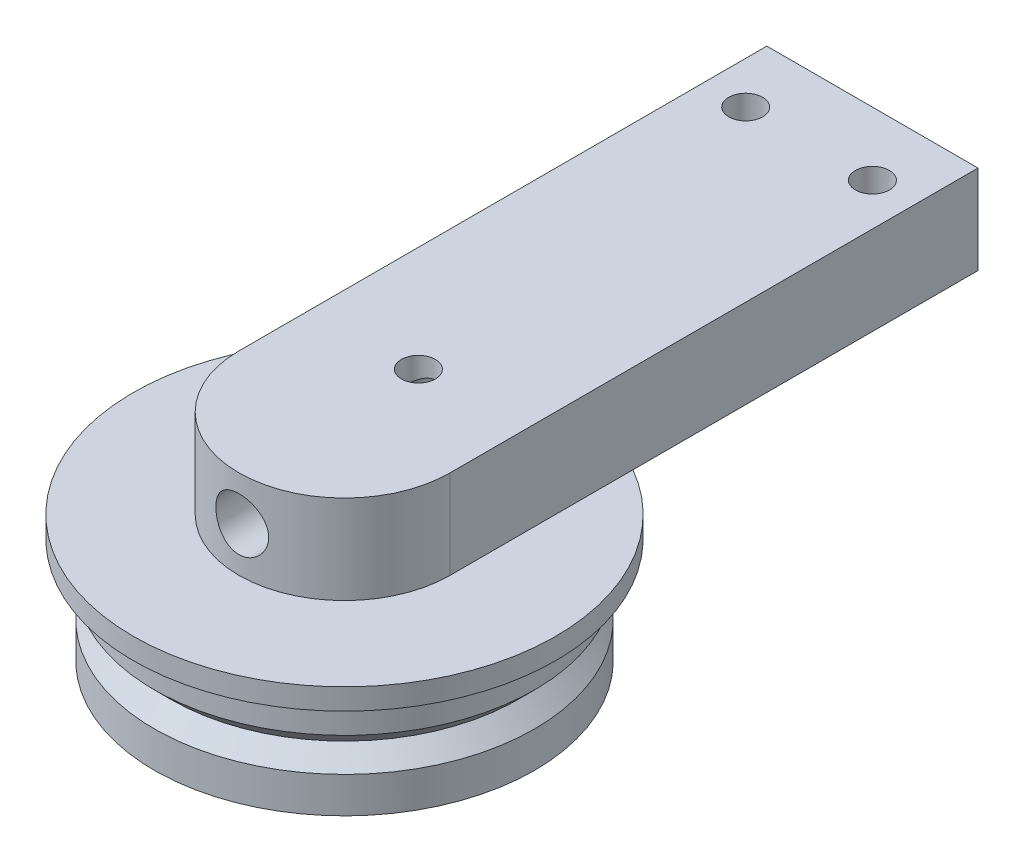
from build123d import *

# Parameters (mm, degrees)
BOSS_EXTRUDE1_DEPTH         = 13.352390271
SKETCH4_R                   = 28.575
BOSS_EXTRUDE2_DEPTH         = 19.05
SKETCH5_R                   = 31.75
SKETCH5_R_2                 = 28.575
BOSS_EXTRUDE3_DEPTH         = 3.175
F_3_8_16_TAPPED_HOLE1_D     = 7.9375
F_1_4_20_TAPPED_HOLE2_D     = 5.1054
F_1_4_20_TAPPED_HOLE2_DEPTH = 118.27002
F_1_4_20_TAPPED_HOLE2_TIP   = 1.533816902
SKETCH2_R                   = 6.35
BOSS_EXTRUDE6_DEPTH         = 37.990390271
SKETCH23_W                  = 0.4064
SKETCH23_H                  = 0.9906


with BuildPart() as part:
    # Sketch1 → Boss-Extrude1 (new body)
    with BuildSketch(Plane(origin=(0, 0, 0), x_dir=(1, 0, 0), z_dir=(0, 1, 0))):
        with BuildLine():
            Line((-15.875, 0), (-15.875, 79.375))
            Line((-15.875, 79.375), (15.875, 79.375))
            Line((15.875, 79.375), (15.875, 0))
            ThreePointArc((15.875, 0), (0, -15.875), (-15.875, 0))
        make_face()
    extrude(amount=BOSS_EXTRUDE1_DEPTH)

    # Sketch4 → Boss-Extrude2 (add)
    with BuildSketch(Plane.XZ):
        Circle(SKETCH4_R)
    extrude(amount=BOSS_EXTRUDE2_DEPTH)

    # Sketch5 → Boss-Extrude3 (add)
    with BuildSketch(Plane.XZ):
        with Locations(Location((0, 0, 0), (0, 0, 240))):
            Circle(SKETCH5_R)
        Circle(SKETCH5_R_2, mode=Mode.SUBTRACT)
    extrude(amount=BOSS_EXTRUDE3_DEPTH)

    # 3/8-16 Tapped Hole1 (through all)
    with Locations(Plane(origin=(0, 0, -79.375), x_dir=(-1, 0, 0), z_dir=(0, 0, -1))):
        with Locations((0, 6.676195135)):
            Hole(F_3_8_16_TAPPED_HOLE1_D / 2)

    # 1/4-20 Tapped Hole2
    with Locations(Plane(origin=(0, 13.352390271, 0), x_dir=(1, 0, 0), z_dir=(0, 1, 0))):
        with Locations((-9.525, 69.85), (9.525, 69.85), (0, 11.1125)):
            Hole(F_1_4_20_TAPPED_HOLE2_D / 2, depth=F_1_4_20_TAPPED_HOLE2_DEPTH)
            with Locations((0, 0, -(F_1_4_20_TAPPED_HOLE2_DEPTH + F_1_4_20_TAPPED_HOLE2_TIP / 2))):  # 118° drill point
                Cone(0, F_1_4_20_TAPPED_HOLE2_D / 2, F_1_4_20_TAPPED_HOLE2_TIP, mode=Mode.SUBTRACT)

    # Sketch22 → Cut-Revolve2 (revolve, cut)
    with BuildSketch(Plane.XY, mode=Mode.PRIVATE) as cut_revolve2_sk:
        Polygon((28.575, -8.5725), (26.035, -11.1125), (28.575, -13.6525), align=None)
    revolve(cut_revolve2_sk.sketch.rotate(Axis((0, -19.050000001, 0), (0, 1, 0)), 90), axis=Axis((0, -19.050000001, 0), (0, 1, 0)), mode=Mode.SUBTRACT)

    # Sketch2 → Boss-Extrude6 (add)
    with BuildSketch(Plane(origin=(0, 13.352390271, 0), x_dir=(1, 0, 0), z_dir=(0, 1, 0))):
        Circle(SKETCH2_R)
    extrude(amount=-BOSS_EXTRUDE6_DEPTH)

    # Sketch23 → Cut-Revolve4 (revolve, cut)
    with BuildSketch(Plane(origin=(0, 0, 0), x_dir=(0, 0, -1), z_dir=(1, 0, 0)), mode=Mode.PRIVATE) as cut_revolve4_sk:
        with Locations((-6.1468, -16.384583292)):
            Rectangle(SKETCH23_W, SKETCH23_H)
    revolve(cut_revolve4_sk.sketch.rotate(Axis((0, -24.638, 0), (0, 1, 0)), 180), axis=Axis((0, -24.638, 0), (0, 1, 0)), mode=Mode.SUBTRACT)


solid = part.part
